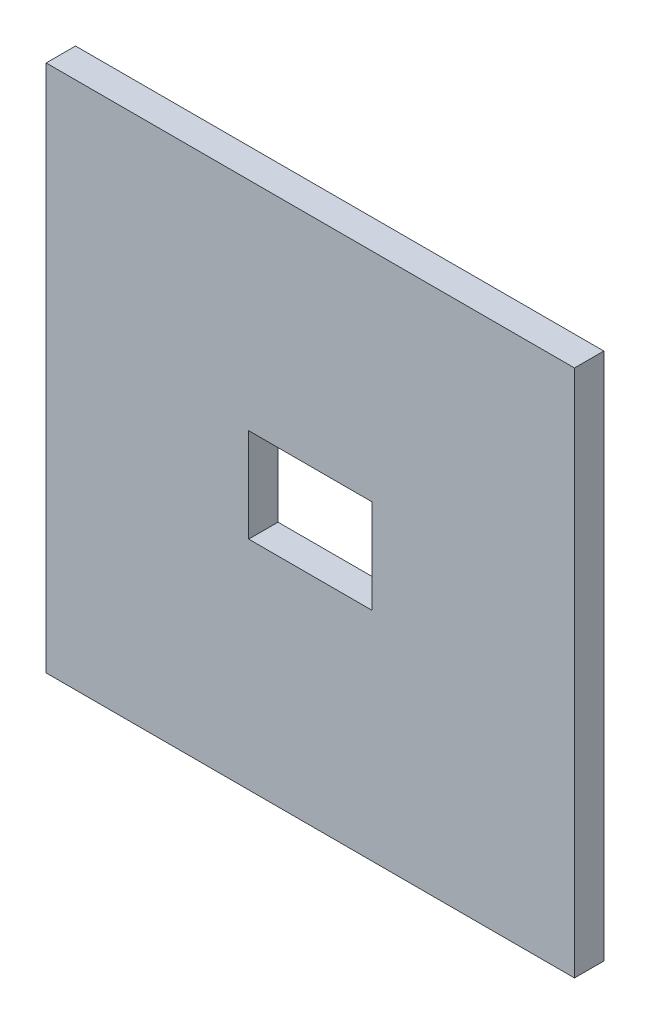
from build123d import *

# Parameters (mm, degrees)
SKETCH1_W           = 90
SKETCH1_H           = 90
SKETCH1_W_2         = 21
SKETCH1_H_2         = 16
BOSS_EXTRUDE1_DEPTH = 5


with BuildPart() as part:
    # Sketch1 → Boss-Extrude1 (new body)
    with BuildSketch(Plane(origin=(0, 0, 0), x_dir=(-1, 0, 0), z_dir=(0, 0, -1))):
        Rectangle(SKETCH1_W, SKETCH1_H)
        Rectangle(SKETCH1_W_2, SKETCH1_H_2, mode=Mode.SUBTRACT)
    extrude(amount=-BOSS_EXTRUDE1_DEPTH)


solid = part.part
